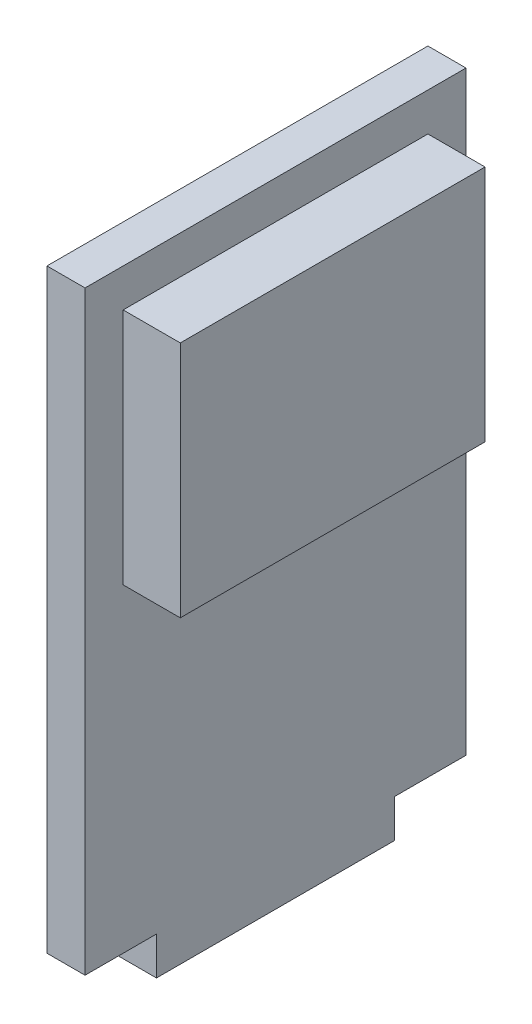
from build123d import *

# Parameters (mm, degrees)
RESSALTO_EXTRUS_O1_DEPTH = 0.8
ESBO_O2_W                = 6.4
ESBO_O2_H                = 5
RESSALTO_EXTRUS_O2_DEPTH = 1.2


with BuildPart() as part:
    # Esboço1 → Ressalto-extrusão1 (new body)
    with BuildSketch(Plane(origin=(0, 0, 0), x_dir=(0, 0, -1), z_dir=(1, 0, 0))):
        Polygon((0, 0), (1.5, 0), (1.5, -0.8), (6.5, -0.8), (6.5, 0), (8, 0), (8, 12.5), (0, 12.5), align=None)
    extrude(amount=RESSALTO_EXTRUS_O1_DEPTH)

    # Esboço2 → Ressalto-extrusão2 (add)
    with BuildSketch(Plane(origin=(0.8, 0, 0), x_dir=(0, 0, -1), z_dir=(1, 0, 0))):
        with Locations((4, 9.2)):
            Rectangle(ESBO_O2_W, ESBO_O2_H)
    extrude(amount=RESSALTO_EXTRUS_O2_DEPTH)


solid = part.part
